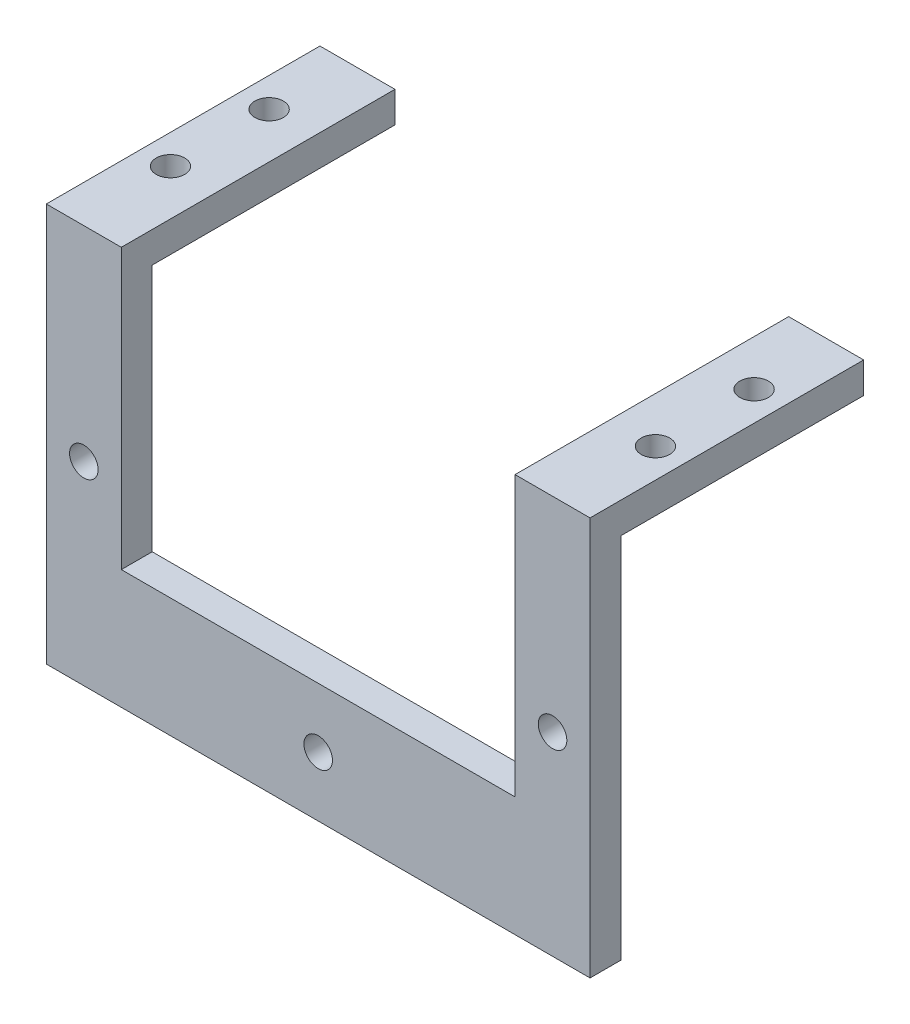
from build123d import *

# Parameters (mm, degrees)
BOSS_EXTRUDE4_DEPTH = 1.59
SKETCH5_W           = 7.725
SKETCH5_H           = 25
SKETCH5_R           = 1.47
BOSS_EXTRUDE5_DEPTH = 3.18
SKETCH7_R           = 1.47
CUT_EXTRUDE1_DEPTH  = 52.250588065


with BuildPart() as part:
    # Sketch2 → Boss-Extrude4 (new, symmetric)
    with BuildSketch(Plane.XY):
        Polygon((-28, -6.144451952), (28, -6.144451952), (28, 12.576257704), (28, 34.894451952), (20.275, 34.894451952), (20.275, 6.144451952), (-20.275, 6.144451952), (-20.275, 34.894451952), (-28, 34.894451952), (-28, 2.372923503), align=None)
    extrude(amount=BOSS_EXTRUDE4_DEPTH, both=True)

    # Sketch5 → Boss-Extrude5 (add)
    with BuildSketch(Plane(origin=(0, 34.894451952, 0), x_dir=(1, 0, 0), z_dir=(0, 1, 0))):
        with Locations((24.1375, 14.09)):
            Rectangle(SKETCH5_W, SKETCH5_H)
        with Locations(Location((24.975, 8.17, 0), (0, 0, 270))):
            Circle(SKETCH5_R, mode=Mode.SUBTRACT)
        with Locations(Location((24.975, 18.33, 0), (0, 0, 270))):
            Circle(SKETCH5_R, mode=Mode.SUBTRACT)
    boss_extrude5 = extrude(amount=-BOSS_EXTRUDE5_DEPTH)

    # Mirror1: Boss-Extrude5 across plane
    add(boss_extrude5.mirror(Plane(origin=(0, 0, 0), x_dir=(0, 0, 1), z_dir=(1, 0, 0))))

    # Sketch7 → Cut-Extrude1 (cut, through all)
    with BuildSketch(Plane(origin=(0, 0, -1.59), x_dir=(-1, 0, 0), z_dir=(0, 0, -1))):
        Circle(SKETCH7_R)
        with Locations((24.1375, 13.855548048)):
            Circle(SKETCH7_R)
        with Locations((-24.1375, 13.855548048)):
            Circle(SKETCH7_R)
    extrude(amount=-CUT_EXTRUDE1_DEPTH, mode=Mode.SUBTRACT)


solid = part.part
